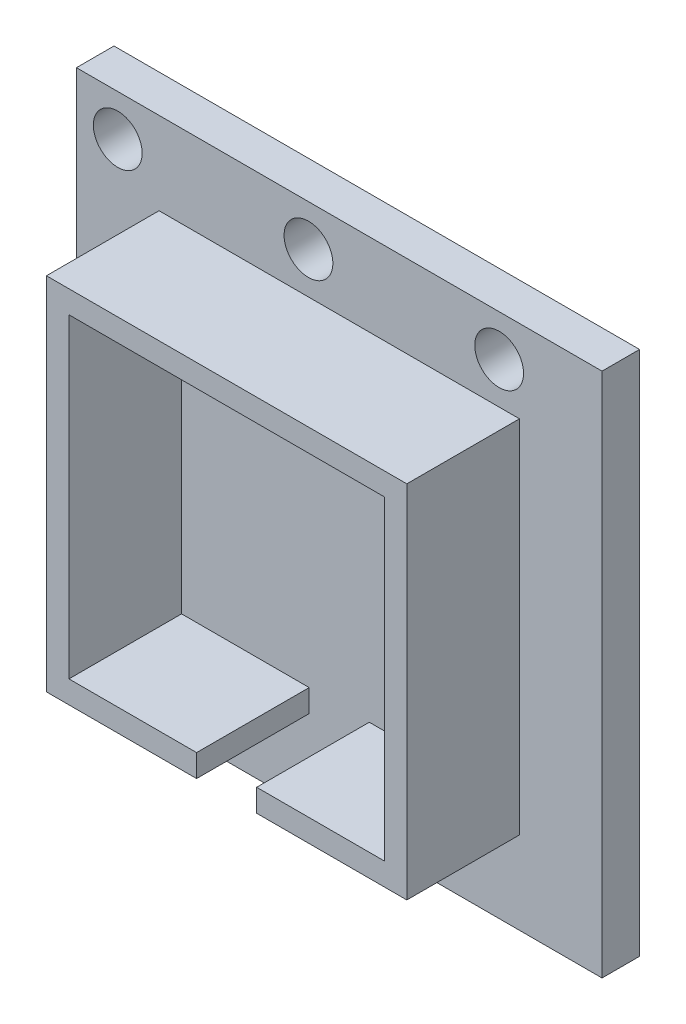
from build123d import *

# Parameters (mm, degrees)
SKETCH1_W          = 70
SKETCH1_H          = 70
EXTRUDE1_DEPTH     = 5
SKETCH2_W          = 48
SKETCH2_H          = 48
SKETCH2_W_2        = 42
SKETCH2_H_2        = 42
EXTRUDE2_DEPTH     = 15
SKETCH5_R          = 3.25
CUT_EXTRUDE2_DEPTH = 101.124921973
SKETCH6_W          = 8
SKETCH6_H          = 8
CUT_EXTRUDE3_DEPTH = 15


with BuildPart() as part:
    # Sketch1 → Extrude1 (new body)
    with BuildSketch(Plane.XY):
        with Locations((35, 35)):
            Rectangle(SKETCH1_W, SKETCH1_H)
    extrude(amount=EXTRUDE1_DEPTH)

    # Sketch2 → Extrude2 (add)
    with BuildSketch(Plane.XY.offset(5)):
        with Locations((35, 35)):
            Rectangle(SKETCH2_W, SKETCH2_H)
        with Locations((35, 35)):
            Rectangle(SKETCH2_W_2, SKETCH2_H_2, mode=Mode.SUBTRACT)
    extrude(amount=EXTRUDE2_DEPTH)

    # Sketch5 → Cut-Extrude2 (cut, through all)
    with BuildSketch(Plane.XY.offset(5)):
        with Locations((5.5, 64.5)):
            Circle(SKETCH5_R)
        with Locations((30.9, 64.5)):
            Circle(SKETCH5_R)
        with Locations((56.3, 64.5)):
            Circle(SKETCH5_R)
        with Locations((5.5, 39.1)):
            Circle(SKETCH5_R)
        with Locations((5.5, 13.7)):
            Circle(SKETCH5_R)
    extrude(amount=-CUT_EXTRUDE2_DEPTH, mode=Mode.SUBTRACT)

    # Sketch6 → Cut-Extrude3 (cut)
    with BuildSketch(Plane.XY.offset(20)):
        with Locations((35, 14)):
            Rectangle(SKETCH6_W, SKETCH6_H)
    extrude(amount=-CUT_EXTRUDE3_DEPTH, mode=Mode.SUBTRACT)


solid = part.part
